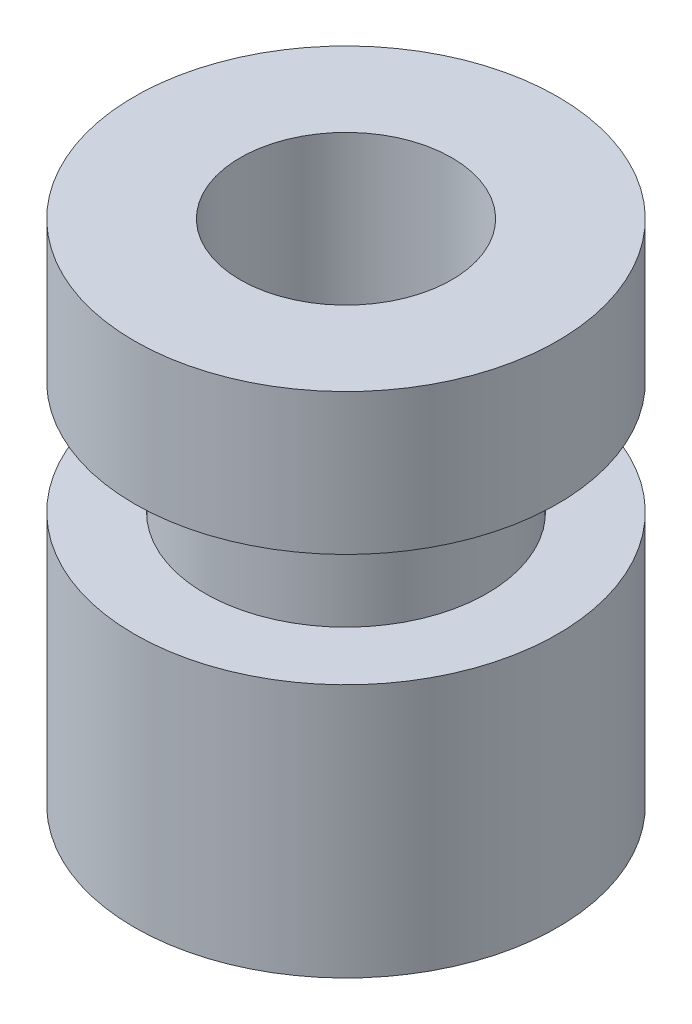
from build123d import *


with BuildPart() as part:
    # Sketch1 → Revolve1 (revolve)
    with BuildSketch(Plane.XY, mode=Mode.PRIVATE) as revolve1_sk:
        Polygon((1.5, 7.2), (3, 7.2), (3, 5.2), (2, 5.2), (2, 3.6), (3, 3.6), (3, 0), (1.5, 0), align=None)
    revolve(revolve1_sk.sketch.rotate(Axis((0, 0, 0), (0, 1, 0)), 90), axis=Axis((0, 0, 0), (0, 1, 0)))


solid = part.part
